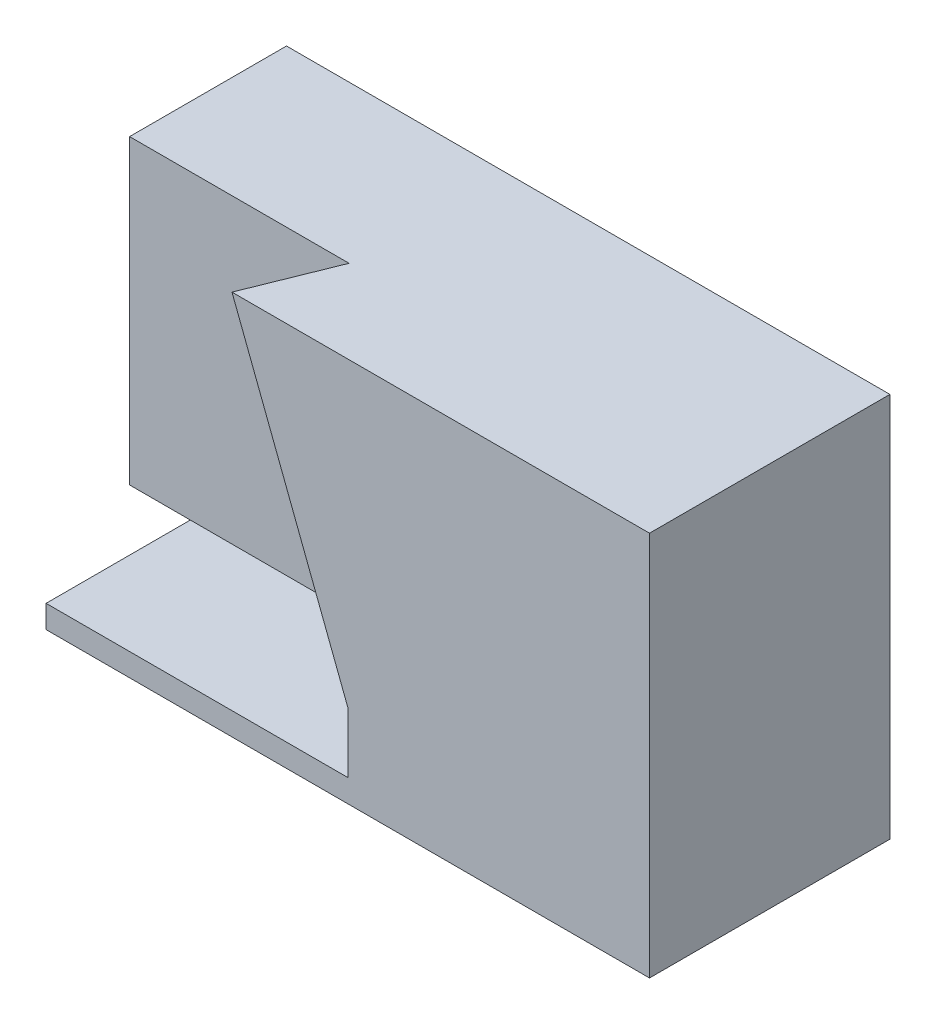
from build123d import *

# Parameters (mm, degrees)
SKETCH1_W               = 1206.5
SKETCH1_H               = 419.1
BOSS_EXTRUDE4_DEPTH     = 1514.1575
SKETCH8_W               = 1206.5
SKETCH8_H               = 114.3
BOSS_EXTRUDE5_DEPTH     = 1514.1575
CUT_EXTRUDE3_DEPTH      = 3416.979003042
CUT_EXTRUDE3_DEPTH_BACK = 304.8
BOSS_EXTRUDE6_DEPTH     = 1514.1575
CUT_EXTRUDE4_REACH      = 4160.577
BOSS_EXTRUDE11_DEPTH    = 451.741385412
BOSS_EXTRUDE12_DEPTH    = 1514.1575


with BuildPart() as part:
    # Sketch1 → Boss-Extrude4 (new body)
    with BuildSketch(Plane(origin=(0, 0, 0), x_dir=(0, 0, -1), z_dir=(1, 0, 0))):
        with Locations((-920.75, 684.714248705)):
            Rectangle(SKETCH1_W, SKETCH1_H)
    extrude(amount=-BOSS_EXTRUDE4_DEPTH)

    # Sketch8 → Boss-Extrude5 (add)
    with BuildSketch(Plane.ZY.offset(1514.1575)):
        with Locations((920.75, 532.314248705)):
            Rectangle(SKETCH8_W, SKETCH8_H)
    extrude(amount=BOSS_EXTRUDE5_DEPTH)

    # Sketch9 → Cut-Extrude3 (cut, two sides: drawn at the far end of the back side and taken through both)
    with BuildSketch(Plane(origin=(0, 894.264248705, 0), x_dir=(1, 0, 0), z_dir=(0, 1, 0)).offset(-CUT_EXTRUDE3_DEPTH_BACK)):
        Polygon((-1514.1575, -317.5), (-1345.558955244, -1104.9), (-1514.1575, -1524), align=None)
    extrude(amount=CUT_EXTRUDE3_DEPTH + CUT_EXTRUDE3_DEPTH_BACK, mode=Mode.SUBTRACT)

    # Sketch10 → Boss-Extrude6 (add)
    with BuildSketch(Plane(origin=(0, 894.264248705, 0), x_dir=(1, 0, 0), z_dir=(0, 1, 0))):
        Polygon((-1345.558955244, -1104.9), (0, -1104.9), (0, -317.5), (-3028.315, -317.5), (-3028.315, -1104.9), align=None)
    extrude(amount=BOSS_EXTRUDE6_DEPTH)

    # Cut-Extrude4: up to this plane
    cut_extrude4_end = Plane(origin=(-1514.1575, -628.758932529, 317.5), z_dir=(0.9778354843848671, 0, -0.20937470114083095))
    # Maybe Delete This Sketch → Cut-Extrude4 (cut, up to the surface)
    with BuildSketch(Plane.ZY.offset(3028.315), mode=Mode.PRIVATE) as cut_extrude4_sk1:
        Polygon((1104.9, 894.264248705), (317.5, 1165.387811409), (317.5, 894.264248705), align=None)
    cut_extrude4_tool1 = split(extrude(cut_extrude4_sk1.sketch, amount=-CUT_EXTRUDE4_REACH, mode=Mode.PRIVATE), bisect_by=cut_extrude4_end, keep=Keep.BOTH, mode=Mode.PRIVATE)
    add(cut_extrude4_tool1.solids().sort_by_distance((-3028.315, 984.63877, 579.966667))[0], mode=Mode.SUBTRACT)

    # Sketch24 → Boss-Extrude11 (add, along a direction that is not the sketch's normal)
    with BuildSketch(Plane.XY.offset(1104.9)):
        Polygon((-1345.558955244, 894.264248705), (-1926.789562873, 2408.421748705), (0, 2408.421748705), (0, 894.264248705), align=None)
    extrude(amount=BOSS_EXTRUDE11_DEPTH, dir=(-0.37321916964166585, 0, 0.9277432033768749))

    # Sketch23 → Boss-Extrude12 (add)
    with BuildSketch(Plane(origin=(0, 894.264248705, 0), x_dir=(1, 0, 0), z_dir=(0, 1, 0))):
        Polygon((-1345.558955244, -1104.9), (-1514.1575, -1524), (0, -1524), (0, -1104.9), align=None)
    extrude(amount=BOSS_EXTRUDE12_DEPTH)


solid = part.part
